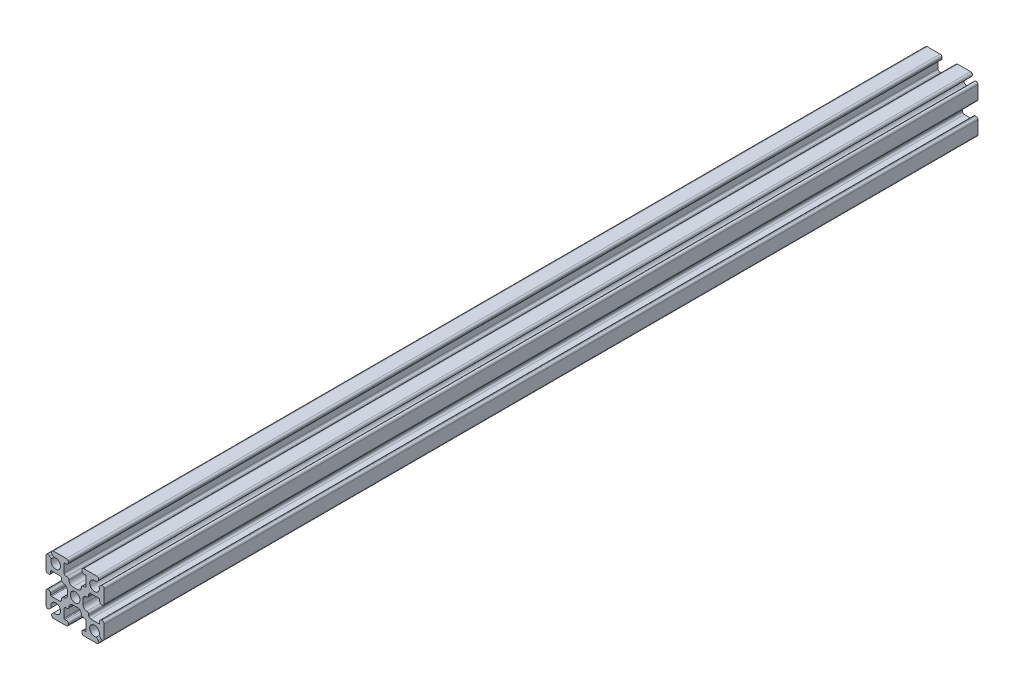
from build123d import *

# Parameters (mm, degrees)
SKETCH1_R           = 1.25
BOSS_EXTRUDE1_DEPTH = 225


with BuildPart() as part:
    # Sketch1 → Boss-Extrude1 (new body)
    with BuildSketch(Plane.XY):
        with BuildLine():
            Line((6.646446609, 5.939339828), (6.163645978, 5.456539197))
            ThreePointArc((6.163645978, 5.456539197), (4.116116524, 4.116116524), (5.456539197, 6.163645978))
            Line((5.456539197, 6.163645978), (5.939339828, 6.646446609))
            ThreePointArc((5.939339828, 6.646446609), (6.047726204, 7.191341716), (5.585786438, 7.5))
            Line((5.585786438, 7.5), (2.25, 7.5))
            ThreePointArc((2.25, 7.5), (1.896446609, 7.353553391), (1.75, 7))
            Line((1.75, 7), (1.75, 6.8))
            ThreePointArc((1.75, 6.8), (1.896446609, 6.446446609), (2.25, 6.3))
            Line((2.25, 6.3), (2.65, 6.3))
            ThreePointArc((2.65, 6.3), (2.791421356, 6.241421356), (2.85, 6.1))
            Line((2.85, 6.1), (2.85, 4))
            ThreePointArc((2.85, 4), (2.703553391, 3.646446609), (2.35, 3.5))
            Line((2.35, 3.5), (2.1, 3.5))
            ThreePointArc((2.1, 3.5), (1.746446609, 3.353553391), (1.6, 3))
            ThreePointArc((1.6, 3), (1.307106781, 2.292893219), (0.6, 2))
            Line((0.6, 2), (-0.6, 2))
            ThreePointArc((-0.6, 2), (-1.307106781, 2.292893219), (-1.6, 3))
            ThreePointArc((-1.6, 3), (-1.746446609, 3.353553391), (-2.1, 3.5))
            Line((-2.1, 3.5), (-2.35, 3.5))
            ThreePointArc((-2.35, 3.5), (-2.703553391, 3.646446609), (-2.85, 4))
            Line((-2.85, 4), (-2.85, 6.1))
            ThreePointArc((-2.85, 6.1), (-2.791421356, 6.241421356), (-2.65, 6.3))
            Line((-2.65, 6.3), (-2.25, 6.3))
            ThreePointArc((-2.25, 6.3), (-1.896446609, 6.446446609), (-1.75, 6.8))
            Line((-1.75, 6.8), (-1.75, 7))
            ThreePointArc((-1.75, 7), (-1.896446609, 7.353553391), (-2.25, 7.5))
            Line((-2.25, 7.5), (-5.585786438, 7.5))
            ThreePointArc((-5.585786438, 7.5), (-6.047726204, 7.191341716), (-5.939339828, 6.646446609))
            Line((-5.939339828, 6.646446609), (-5.456539197, 6.163645978))
            ThreePointArc((-5.456539197, 6.163645978), (-4.116116524, 4.116116524), (-6.163645978, 5.456539197))
            Line((-6.163645978, 5.456539197), (-6.646446609, 5.939339828))
            ThreePointArc((-6.646446609, 5.939339828), (-7.191341716, 6.047726204), (-7.5, 5.585786438))
            Line((-7.5, 5.585786438), (-7.5, 2.25))
            ThreePointArc((-7.5, 2.25), (-7.353553391, 1.896446609), (-7, 1.75))
            Line((-7, 1.75), (-6.8, 1.75))
            ThreePointArc((-6.8, 1.75), (-6.446446609, 1.896446609), (-6.3, 2.25))
            Line((-6.3, 2.25), (-6.3, 2.65))
            ThreePointArc((-6.3, 2.65), (-6.241421356, 2.791421356), (-6.1, 2.85))
            Line((-6.1, 2.85), (-4, 2.85))
            ThreePointArc((-4, 2.85), (-3.646446609, 2.703553391), (-3.5, 2.35))
            Line((-3.5, 2.35), (-3.5, 2.1))
            ThreePointArc((-3.5, 2.1), (-3.353553391, 1.746446609), (-3, 1.6))
            ThreePointArc((-3, 1.6), (-2.292893219, 1.307106781), (-2, 0.6))
            Line((-2, 0.6), (-2, -0.6))
            ThreePointArc((-2, -0.6), (-2.292893219, -1.307106781), (-3, -1.6))
            ThreePointArc((-3, -1.6), (-3.353553391, -1.746446609), (-3.5, -2.1))
            Line((-3.5, -2.1), (-3.5, -2.35))
            ThreePointArc((-3.5, -2.35), (-3.646446609, -2.703553391), (-4, -2.85))
            Line((-4, -2.85), (-6.1, -2.85))
            ThreePointArc((-6.1, -2.85), (-6.241421356, -2.791421356), (-6.3, -2.65))
            Line((-6.3, -2.65), (-6.3, -2.25))
            ThreePointArc((-6.3, -2.25), (-6.446446609, -1.896446609), (-6.8, -1.75))
            Line((-6.8, -1.75), (-7, -1.75))
            ThreePointArc((-7, -1.75), (-7.353553391, -1.896446609), (-7.5, -2.25))
            Line((-7.5, -2.25), (-7.5, -5.585786438))
            ThreePointArc((-7.5, -5.585786438), (-7.191341716, -6.047726204), (-6.646446609, -5.939339828))
            Line((-6.646446609, -5.939339828), (-6.163645978, -5.456539197))
            ThreePointArc((-6.163645978, -5.456539197), (-4.116116524, -4.116116524), (-5.456539197, -6.163645978))
            Line((-5.456539197, -6.163645978), (-5.939339828, -6.646446609))
            ThreePointArc((-5.939339828, -6.646446609), (-6.047726204, -7.191341716), (-5.585786438, -7.5))
            Line((-5.585786438, -7.5), (-2.25, -7.5))
            ThreePointArc((-2.25, -7.5), (-1.896446609, -7.353553391), (-1.75, -7))
            Line((-1.75, -7), (-1.75, -6.8))
            ThreePointArc((-1.75, -6.8), (-1.896446609, -6.446446609), (-2.25, -6.3))
            Line((-2.25, -6.3), (-2.65, -6.3))
            ThreePointArc((-2.65, -6.3), (-2.791421356, -6.241421356), (-2.85, -6.1))
            Line((-2.85, -6.1), (-2.85, -4))
            ThreePointArc((-2.85, -4), (-2.703553391, -3.646446609), (-2.35, -3.5))
            Line((-2.35, -3.5), (-2.1, -3.5))
            ThreePointArc((-2.1, -3.5), (-1.746446609, -3.353553391), (-1.6, -3))
            ThreePointArc((-1.6, -3), (-1.307106781, -2.292893219), (-0.6, -2))
            Line((-0.6, -2), (0.6, -2))
            ThreePointArc((0.6, -2), (1.307106781, -2.292893219), (1.6, -3))
            ThreePointArc((1.6, -3), (1.746446609, -3.353553391), (2.1, -3.5))
            Line((2.1, -3.5), (2.35, -3.5))
            ThreePointArc((2.35, -3.5), (2.703553391, -3.646446609), (2.85, -4))
            Line((2.85, -4), (2.85, -6.1))
            ThreePointArc((2.85, -6.1), (2.791421356, -6.241421356), (2.65, -6.3))
            Line((2.65, -6.3), (2.25, -6.3))
            ThreePointArc((2.25, -6.3), (1.896446609, -6.446446609), (1.75, -6.8))
            Line((1.75, -6.8), (1.75, -7))
            ThreePointArc((1.75, -7), (1.896446609, -7.353553391), (2.25, -7.5))
            Line((2.25, -7.5), (5.585786438, -7.5))
            ThreePointArc((5.585786438, -7.5), (6.047726204, -7.191341716), (5.939339828, -6.646446609))
            Line((5.939339828, -6.646446609), (5.456539197, -6.163645978))
            ThreePointArc((5.456539197, -6.163645978), (4.116116524, -4.116116524), (6.163645978, -5.456539197))
            Line((6.163645978, -5.456539197), (6.646446609, -5.939339828))
            ThreePointArc((6.646446609, -5.939339828), (7.191341716, -6.047726204), (7.5, -5.585786438))
            Line((7.5, -5.585786438), (7.5, -2.25))
            ThreePointArc((7.5, -2.25), (7.353553391, -1.896446609), (7, -1.75))
            Line((7, -1.75), (6.8, -1.75))
            ThreePointArc((6.8, -1.75), (6.446446609, -1.896446609), (6.3, -2.25))
            Line((6.3, -2.25), (6.3, -2.65))
            ThreePointArc((6.3, -2.65), (6.241421356, -2.791421356), (6.1, -2.85))
            Line((6.1, -2.85), (4, -2.85))
            ThreePointArc((4, -2.85), (3.646446609, -2.703553391), (3.5, -2.35))
            Line((3.5, -2.35), (3.5, -2.1))
            ThreePointArc((3.5, -2.1), (3.353553391, -1.746446609), (3, -1.6))
            ThreePointArc((3, -1.6), (2.292893219, -1.307106781), (2, -0.6))
            Line((2, -0.6), (2, 0.6))
            ThreePointArc((2, 0.6), (2.292893219, 1.307106781), (3, 1.6))
            ThreePointArc((3, 1.6), (3.353553391, 1.746446609), (3.5, 2.1))
            Line((3.5, 2.1), (3.5, 2.35))
            ThreePointArc((3.5, 2.35), (3.646446609, 2.703553391), (4, 2.85))
            Line((4, 2.85), (6.1, 2.85))
            ThreePointArc((6.1, 2.85), (6.241421356, 2.791421356), (6.3, 2.65))
            Line((6.3, 2.65), (6.3, 2.25))
            ThreePointArc((6.3, 2.25), (6.446446609, 1.896446609), (6.8, 1.75))
            Line((6.8, 1.75), (7, 1.75))
            ThreePointArc((7, 1.75), (7.353553391, 1.896446609), (7.5, 2.25))
            Line((7.5, 2.25), (7.5, 5.585786438))
            ThreePointArc((7.5, 5.585786438), (7.191341716, 6.047726204), (6.646446609, 5.939339828))
        make_face()
        with Locations(Location((0, 0, 0), (0, 0, 180))):
            Circle(SKETCH1_R, mode=Mode.SUBTRACT)
    extrude(amount=BOSS_EXTRUDE1_DEPTH)


solid = part.part
